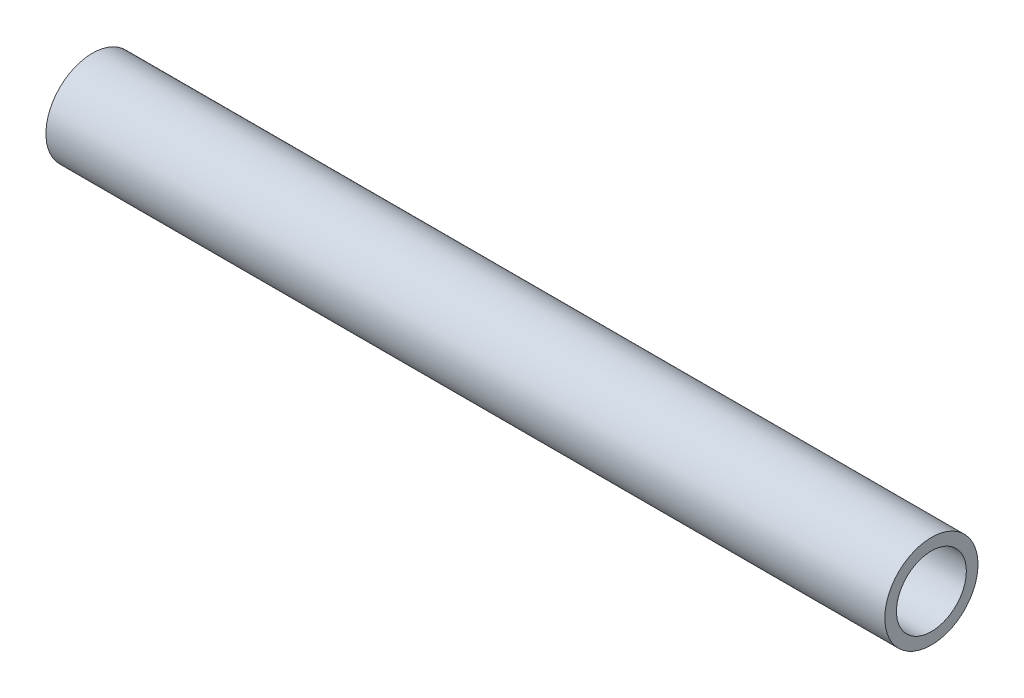
from build123d import *

# Parameters (mm, degrees)
SKETCH_1_R      = 2
SKETCH_1_R_2    = 1.5
EXTRUDE_1_DEPTH = 36


with BuildPart() as part:
    # 草图1 → 凸台-拉伸1 (new body)
    with BuildSketch(Plane(origin=(0, 0, 0), x_dir=(0, 0, -1), z_dir=(1, 0, 0))):
        Circle(SKETCH_1_R)
        Circle(SKETCH_1_R_2, mode=Mode.SUBTRACT)
    extrude(amount=EXTRUDE_1_DEPTH)


solid = part.part
